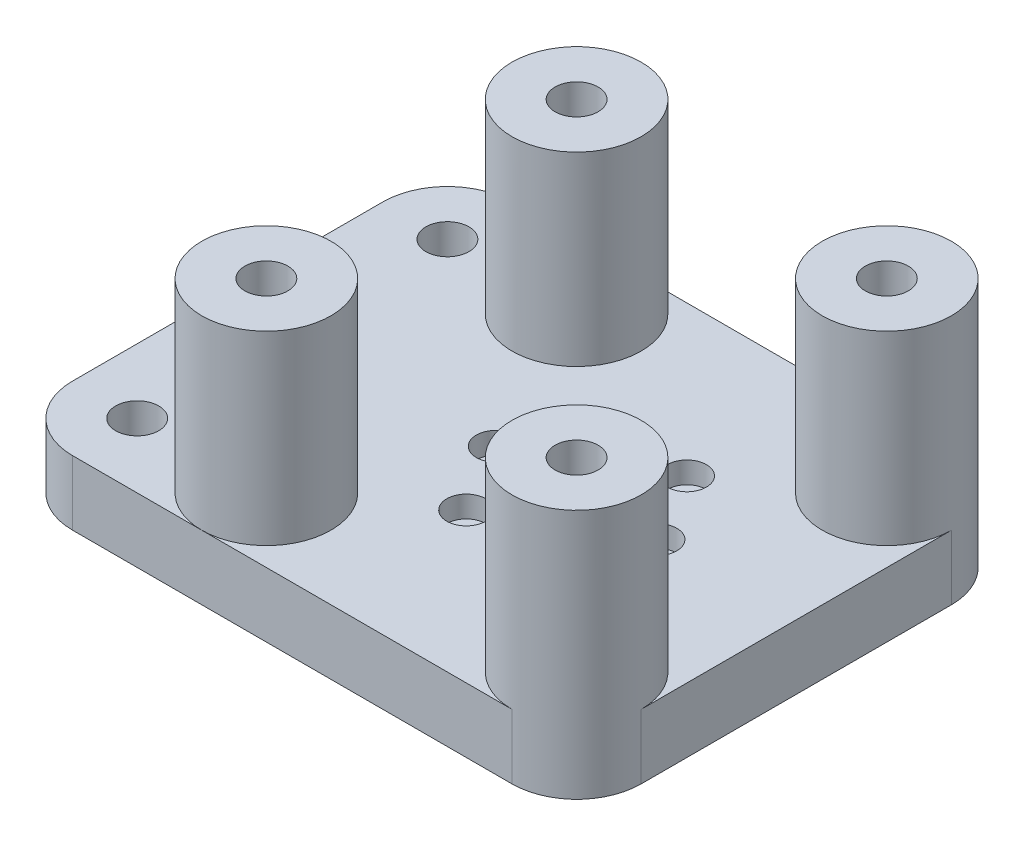
from build123d import *

# Parameters (mm, degrees)
SKETCH1_R                = 4
SKETCH1_R_2              = 10.5
SKETCH1_R_3              = 2
BASE_DEPTH               = 12
SKETCH2_R                = 3.625
BOLT_HEAD_RECESSES_DEPTH = 4
SKETCH3_R                = 12
SKETCH3_R_2              = 4
BOSS_EXTRUDE1_DEPTH      = 34.5


with BuildPart() as part:
    # Sketch1 → base (new body)
    with BuildSketch(Plane(origin=(0, 0, 0), x_dir=(1, 0, 0), z_dir=(0, 1, 0))):
        with BuildLine():
            Line((-52.814601333, 40.814601333), (28.814601333, 40.814601333))
            ThreePointArc((28.814601333, 40.814601333), (37.299882708, 37.299882708), (40.814601333, 28.814601333))
            Line((40.814601333, 28.814601333), (40.814601333, -28.814601333))
            ThreePointArc((40.814601333, -28.814601333), (37.299882708, -37.299882708), (28.814601333, -40.814601333))
            Line((28.814601333, -40.814601333), (-52.814601333, -40.814601333))
            ThreePointArc((-52.814601333, -40.814601333), (-61.299882708, -37.299882708), (-64.814601333, -28.814601333))
            Line((-64.814601333, -28.814601333), (-64.814601333, 28.814601333))
            ThreePointArc((-64.814601333, 28.814601333), (-61.299882708, 37.299882708), (-52.814601333, 40.814601333))
        make_face()
        with Locations(Location((-28.814601333, 28.814601333, 0), (0, 0, 270))):
            Circle(SKETCH1_R, mode=Mode.SUBTRACT)
        with Locations(Location((28.814601333, 28.814601333, 0), (0, 0, 270))):
            Circle(SKETCH1_R, mode=Mode.SUBTRACT)
        with Locations(Location((28.814601333, -28.814601333, 0), (0, 0, 270))):
            Circle(SKETCH1_R, mode=Mode.SUBTRACT)
        with Locations(Location((-28.814601333, -28.814601333, 0), (0, 0, 270))):
            Circle(SKETCH1_R, mode=Mode.SUBTRACT)
        with Locations(Location((0, 0, 0), (0, 0, 270))):
            Circle(SKETCH1_R_2, mode=Mode.SUBTRACT)
        with Locations(Location((-7.5, 12.990381057, 0), (0, 0, 270))):
            Circle(SKETCH1_R_3, mode=Mode.SUBTRACT)
        with Locations(Location((7.5, 12.990381057, 0), (0, 0, 270))):
            Circle(SKETCH1_R_3, mode=Mode.SUBTRACT)
        with Locations(Location((15, 0, 0), (0, 0, 270))):
            Circle(SKETCH1_R_3, mode=Mode.SUBTRACT)
        with Locations(Location((7.5, -12.990381057, 0), (0, 0, 270))):
            Circle(SKETCH1_R_3, mode=Mode.SUBTRACT)
        with Locations(Location((-7.5, -12.990381057, 0), (0, 0, 270))):
            Circle(SKETCH1_R_3, mode=Mode.SUBTRACT)
        with Locations(Location((-15, 0, 0), (0, 0, 270))):
            Circle(SKETCH1_R_3, mode=Mode.SUBTRACT)
        with Locations(Location((-52.814601333, 28.814601333, 0), (0, 0, 270))):
            Circle(SKETCH1_R, mode=Mode.SUBTRACT)
        with Locations(Location((-52.814601333, -28.814601333, 0), (0, 0, 270))):
            Circle(SKETCH1_R, mode=Mode.SUBTRACT)
    extrude(amount=BASE_DEPTH)

    # Sketch2 → bolt head recesses (cut)
    with BuildSketch(Plane(origin=(0, 12, 0), x_dir=(1, 0, 0), z_dir=(0, 1, 0))):
        with Locations(Location((-7.5, 12.990381057, 0), (0, 0, 270))):
            Circle(SKETCH2_R)
        with Locations(Location((7.5, 12.990381057, 0), (0, 0, 270))):
            Circle(SKETCH2_R)
        with Locations(Location((15, 0, 0), (0, 0, 270))):
            Circle(SKETCH2_R)
        with Locations(Location((7.5, -12.990381057, 0), (0, 0, 270))):
            Circle(SKETCH2_R)
        with Locations(Location((-7.5, -12.990381057, 0), (0, 0, 270))):
            Circle(SKETCH2_R)
        with Locations(Location((-15, 0, 0), (0, 0, 270))):
            Circle(SKETCH2_R)
    extrude(amount=-BOLT_HEAD_RECESSES_DEPTH, mode=Mode.SUBTRACT)

    # Sketch3 → Boss-Extrude1 (add)
    # profile 1 of 4: a face of its own
    with BuildSketch(Plane(origin=(0, 12, 0), x_dir=(1, 0, 0), z_dir=(0, 1, 0))):
        with Locations(Location((-28.814601333, 28.814601333, 0), (0, 0, 90))):
            Circle(SKETCH3_R)
        with Locations(Location((-28.814601333, 28.814601333, 0), (0, 0, 270))):
            Circle(SKETCH3_R_2, mode=Mode.SUBTRACT)
    # profile 2 of 4: a face of its own
    with BuildSketch(Plane(origin=(0, 12, 0), x_dir=(1, 0, 0), z_dir=(0, 1, 0))):
        with Locations(Location((28.814601333, 28.814601333, 0), (0, 0, 90))):
            Circle(SKETCH3_R)
        with Locations(Location((28.814601333, 28.814601333, 0), (0, 0, 270))):
            Circle(SKETCH3_R_2, mode=Mode.SUBTRACT)
    # profile 3 of 4: a face of its own
    with BuildSketch(Plane(origin=(0, 12, 0), x_dir=(1, 0, 0), z_dir=(0, 1, 0))):
        with Locations(Location((28.814601333, -28.814601333, 0), (0, 0, 270))):
            Circle(SKETCH3_R)
        with Locations(Location((28.814601333, -28.814601333, 0), (0, 0, 270))):
            Circle(SKETCH3_R_2, mode=Mode.SUBTRACT)
    # profile 4 of 4: a face of its own
    with BuildSketch(Plane(origin=(0, 12, 0), x_dir=(1, 0, 0), z_dir=(0, 1, 0))):
        with Locations(Location((-28.814601333, -28.814601333, 0), (0, 0, 270))):
            Circle(SKETCH3_R)
        with Locations(Location((-28.814601333, -28.814601333, 0), (0, 0, 270))):
            Circle(SKETCH3_R_2, mode=Mode.SUBTRACT)
    extrude(amount=BOSS_EXTRUDE1_DEPTH)


solid = part.part
